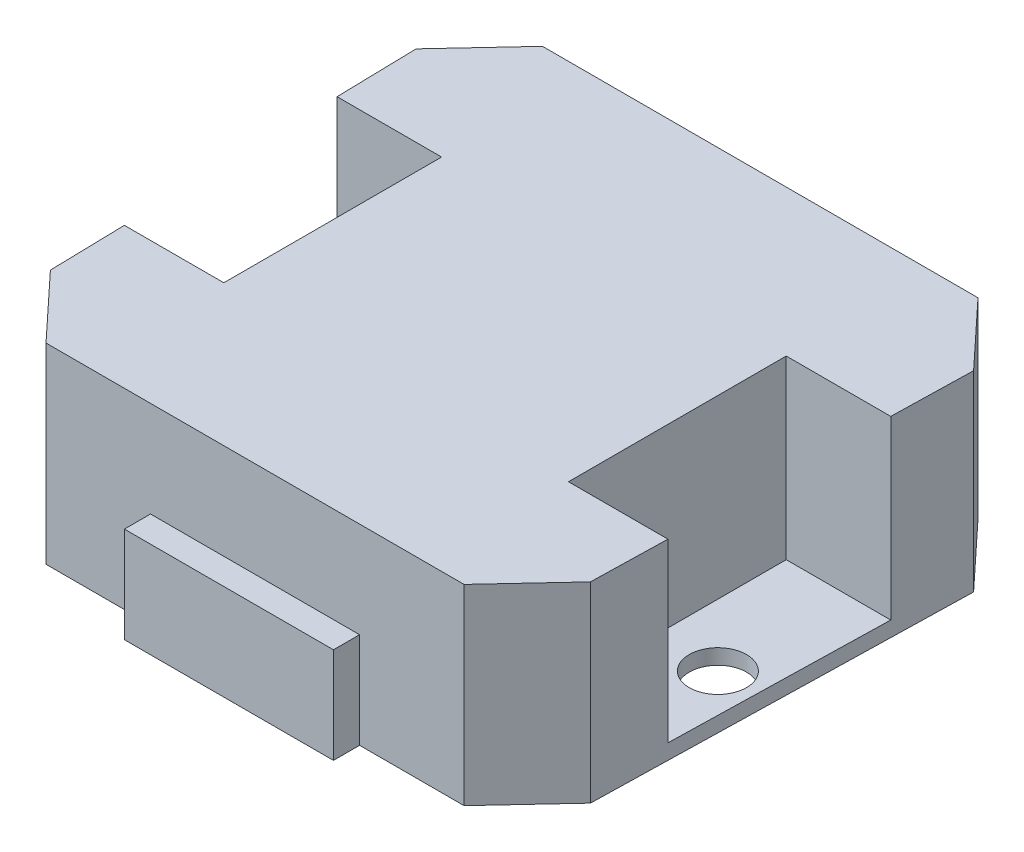
from build123d import *

# Parameters (mm, degrees)
SKETCH1_R           = 3.29
BOSS_EXTRUDE1_DEPTH = 22
SKETCH2_W           = 24
SKETCH2_H           = 11
BOSS_EXTRUDE2_DEPTH = 3
SKETCH3_W           = 12
SKETCH3_H           = 25
CUT_EXTRUDE1_DEPTH  = 20.25


with BuildPart() as part:
    # Sketch1 → Boss-Extrude1 (new body)
    with BuildSketch(Plane(origin=(0, 0, 0), x_dir=(1, 0, 0), z_dir=(0, 1, 0))):
        Polygon((24, -29), (-24, -29), (-31, -21.49418526), (-32, 21.49418526), (-25, 29), (25, 29), (32, 21.49418526), (31, -21.49418526), align=None)
        with Locations(Location((-26.933648737, -2.8, 0), (0, 0, 270))):
            Circle(SKETCH1_R, mode=Mode.SUBTRACT)
        with Locations(Location((26.933648737, -2.8, 0), (0, 0, 270))):
            Circle(SKETCH1_R, mode=Mode.SUBTRACT)
    extrude(amount=BOSS_EXTRUDE1_DEPTH)

    # Sketch2 → Boss-Extrude2 (add)
    with BuildSketch(Plane.XY.offset(29)):
        with Locations((0, 5.5)):
            Rectangle(SKETCH2_W, SKETCH2_H)
    extrude(amount=BOSS_EXTRUDE2_DEPTH)

    # Sketch3 → Cut-Extrude1 (cut)
    with BuildSketch(Plane(origin=(0, 22, 0), x_dir=(1, 0, 0), z_dir=(0, 1, 0))):
        with Locations((-25.783797684, -0.3)):
            Rectangle(SKETCH3_W, SKETCH3_H)
        with Locations((25.783797684, -0.3)):
            Rectangle(SKETCH3_W, SKETCH3_H)
    extrude(amount=-CUT_EXTRUDE1_DEPTH, mode=Mode.SUBTRACT)


solid = part.part
